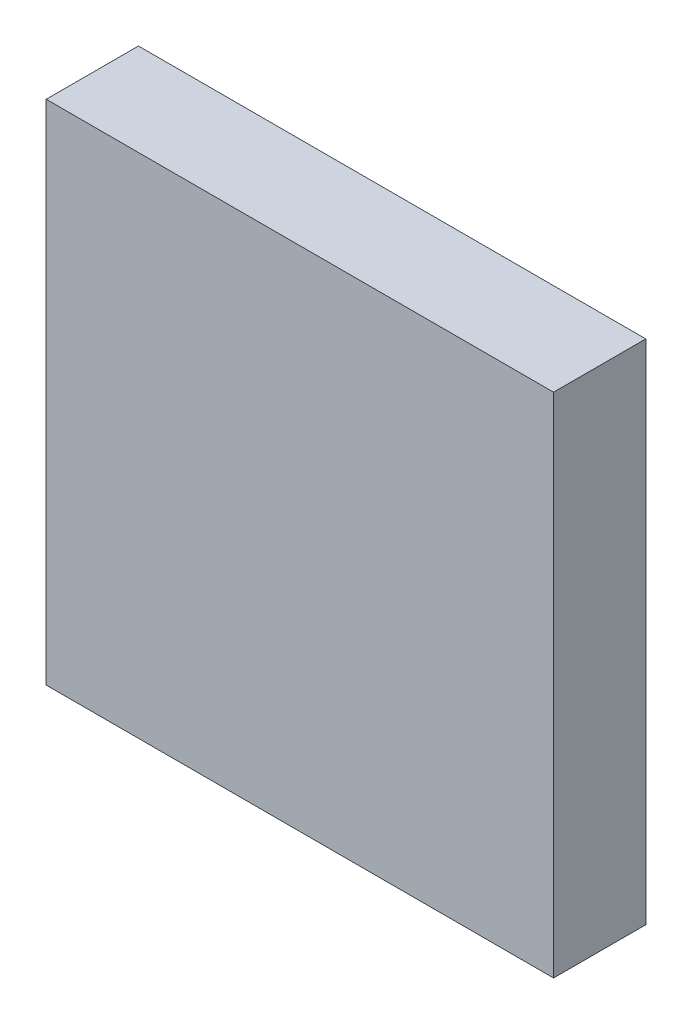
from build123d import *

# Parameters (mm, degrees)
SKETCH1_W           = 139.7
SKETCH1_H           = 25.4
BOSS_EXTRUDE1_DEPTH = 139.7


with BuildPart() as part:
    # Sketch1 → Boss-Extrude1 (new body)
    with BuildSketch(Plane(origin=(0, 0, 0), x_dir=(1, 0, 0), z_dir=(0, 1, 0))):
        Rectangle(SKETCH1_W, SKETCH1_H)
    extrude(amount=BOSS_EXTRUDE1_DEPTH)


solid = part.part
